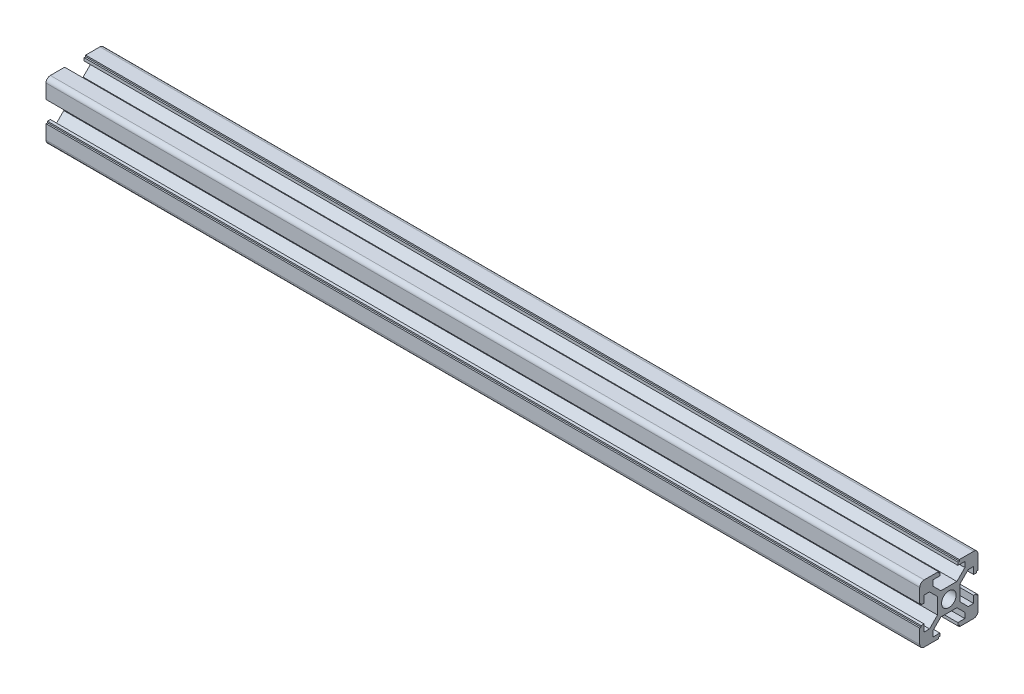
from build123d import *

# Parameters (mm, degrees)
SKETCH1_R                = 2.5
F_20_X_20_X_R1_5_1_DEPTH = 300


with BuildPart() as part:
    # Sketch1 → 铝型材 20 X 20 X R1.5(1) (new body)
    with BuildSketch(Plane.YZ):
        with BuildLine():
            Line((-3.6, 10), (-3.6, 9.5))
            Line((-3.6, 9.5), (-3.1, 9.5))
            Line((-3.1, 9.5), (-3.1, 8.5))
            Line((-3.1, 8.5), (-5.5, 8.5))
            Line((-5.5, 8.5), (-5.5, 6.65))
            Line((-5.5, 6.65), (-2.75, 3.9))
            Line((-2.75, 3.9), (2.75, 3.9))
            Line((2.75, 3.9), (5.5, 6.65))
            Line((5.5, 6.65), (5.5, 8.5))
            Line((5.5, 8.5), (3.1, 8.5))
            Line((3.1, 8.5), (3.1, 9.5))
            Line((3.1, 9.5), (3.6, 9.5))
            Line((3.6, 9.5), (3.6, 10))
            Line((3.6, 10), (8.5, 10))
            ThreePointArc((8.5, 10), (9.560660172, 9.560660172), (10, 8.5))
            Line((10, 8.5), (10, 3.6))
            Line((10, 3.6), (9.5, 3.6))
            Line((9.5, 3.6), (9.5, 3.1))
            Line((9.5, 3.1), (8.5, 3.1))
            Line((8.5, 3.1), (8.5, 5.5))
            Line((8.5, 5.5), (6.65, 5.5))
            Line((6.65, 5.5), (3.9, 2.75))
            Line((3.9, 2.75), (3.9, -2.75))
            Line((3.9, -2.75), (6.65, -5.5))
            Line((6.65, -5.5), (8.5, -5.5))
            Line((8.5, -5.5), (8.5, -3.1))
            Line((8.5, -3.1), (9.5, -3.1))
            Line((9.5, -3.1), (9.5, -3.6))
            Line((9.5, -3.6), (10, -3.6))
            Line((10, -3.6), (10, -8.5))
            ThreePointArc((10, -8.5), (9.560660172, -9.560660172), (8.5, -10))
            Line((8.5, -10), (3.6, -10))
            Line((3.6, -10), (3.6, -9.5))
            Line((3.6, -9.5), (3.1, -9.5))
            Line((3.1, -9.5), (3.1, -8.5))
            Line((3.1, -8.5), (5.5, -8.5))
            Line((5.5, -8.5), (5.5, -6.65))
            Line((5.5, -6.65), (2.75, -3.9))
            Line((2.75, -3.9), (-2.75, -3.9))
            Line((-2.75, -3.9), (-5.5, -6.65))
            Line((-5.5, -6.65), (-5.5, -8.5))
            Line((-5.5, -8.5), (-3.1, -8.5))
            Line((-3.1, -8.5), (-3.1, -9.5))
            Line((-3.1, -9.5), (-3.6, -9.5))
            Line((-3.6, -9.5), (-3.6, -10))
            Line((-3.6, -10), (-8.5, -10))
            ThreePointArc((-8.5, -10), (-9.560660172, -9.560660172), (-10, -8.5))
            Line((-10, -8.5), (-10, -3.6))
            Line((-10, -3.6), (-9.5, -3.6))
            Line((-9.5, -3.6), (-9.5, -3.1))
            Line((-9.5, -3.1), (-8.5, -3.1))
            Line((-8.5, -3.1), (-8.5, -5.5))
            Line((-8.5, -5.5), (-6.65, -5.5))
            Line((-6.65, -5.5), (-3.9, -2.75))
            Line((-3.9, -2.75), (-3.9, 2.75))
            Line((-3.9, 2.75), (-6.65, 5.5))
            Line((-6.65, 5.5), (-8.5, 5.5))
            Line((-8.5, 5.5), (-8.5, 3.1))
            Line((-8.5, 3.1), (-9.5, 3.1))
            Line((-9.5, 3.1), (-9.5, 3.6))
            Line((-9.5, 3.6), (-10, 3.6))
            Line((-10, 3.6), (-10, 8.5))
            ThreePointArc((-10, 8.5), (-9.560660172, 9.560660172), (-8.5, 10))
            Line((-8.5, 10), (-3.6, 10))
        make_face()
        Circle(SKETCH1_R, mode=Mode.SUBTRACT)
    extrude(amount=F_20_X_20_X_R1_5_1_DEPTH)


solid = part.part
